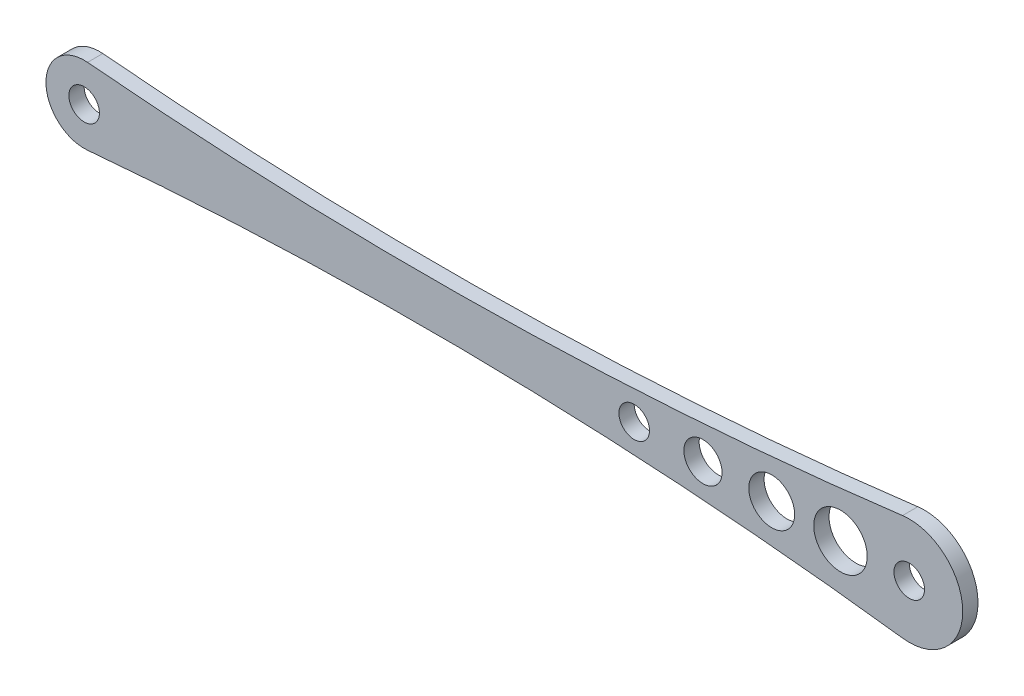
from build123d import *

# Parameters (mm, degrees)
SKETCH_1_R      = 1
SKETCH_1_R_2    = 1.75
SKETCH_1_R_3    = 1.5
SKETCH_1_R_4    = 1.25
EXTRUDE_1_DEPTH = 1


with BuildPart() as part:
    # 草图1 → 凸台-拉伸1 (new body)
    with BuildSketch(Plane.XY):
        with BuildLine():
            ThreePointArc((0.223222552, 2.490014396), (-2.5, 0), (0.223222552, -2.490014396))
            ThreePointArc((0.223222552, -2.490014396), (26.917790455, -1.542011473), (53.559359935, -3.472151542))
            ThreePointArc((53.559359935, -3.472151542), (57.5, 0), (53.559359935, 3.472151542))
            ThreePointArc((53.559359935, 3.472151542), (26.917790455, 1.542011473), (0.223222552, 2.490014396))
        make_face()
        Circle(SKETCH_1_R, mode=Mode.SUBTRACT)
        with Locations((54, 0)):
            Circle(SKETCH_1_R, mode=Mode.SUBTRACT)
        with Locations((49.5, 0)):
            Circle(SKETCH_1_R_2, mode=Mode.SUBTRACT)
        with Locations((45, 0)):
            Circle(SKETCH_1_R_3, mode=Mode.SUBTRACT)
        with Locations((40.5, 0)):
            Circle(SKETCH_1_R_4, mode=Mode.SUBTRACT)
        with Locations((36, 0)):
            Circle(SKETCH_1_R, mode=Mode.SUBTRACT)
    extrude(amount=EXTRUDE_1_DEPTH)


solid = part.part
